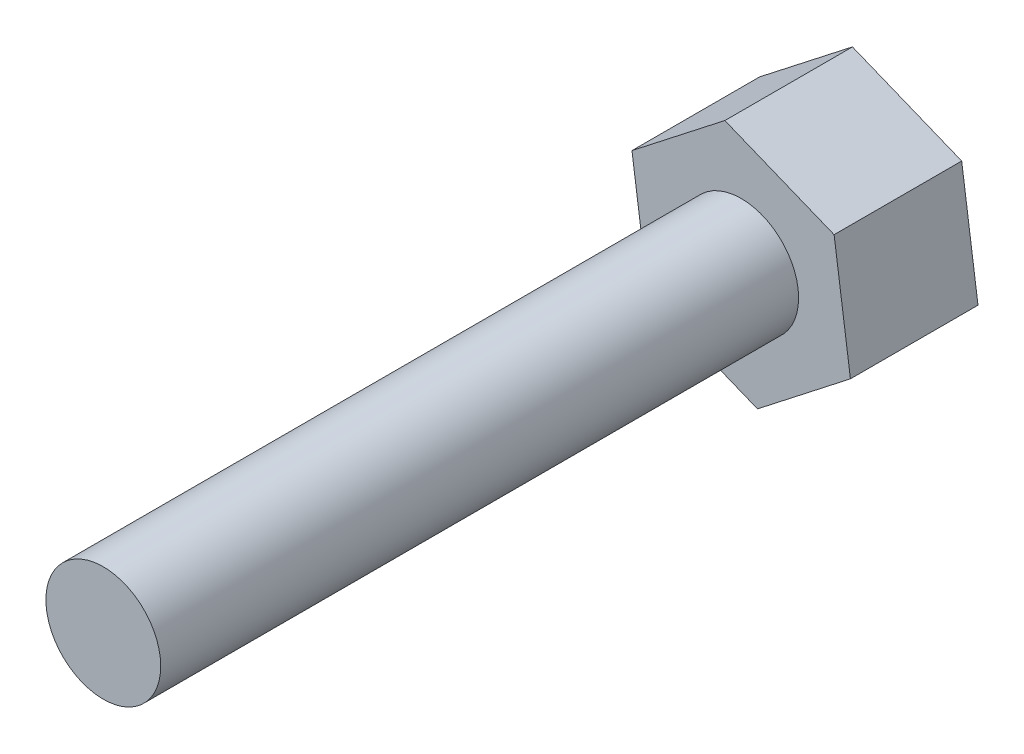
from build123d import *

# Parameters (mm, degrees)
BOSS_EXTRUDE2_DEPTH = 5
SKETCH2_R           = 2.25
BOSS_EXTRUDE3_DEPTH = 25


with BuildPart() as part:
    # Sketch1 → Boss-Extrude2 (new body)
    with BuildSketch(Plane.XY):
        Polygon((3.641936149, 2.840710196), (-0.63915912, 4.574364322), (-4.281095269, 1.733654126), (-3.641936149, -2.840710196), (0.63915912, -4.574364322), (4.281095269, -1.733654126), align=None)
    extrude(amount=BOSS_EXTRUDE2_DEPTH)

    # Sketch2 → Boss-Extrude3 (add)
    with BuildSketch(Plane.XY.offset(5)):
        Circle(SKETCH2_R)
    extrude(amount=BOSS_EXTRUDE3_DEPTH)


solid = part.part
